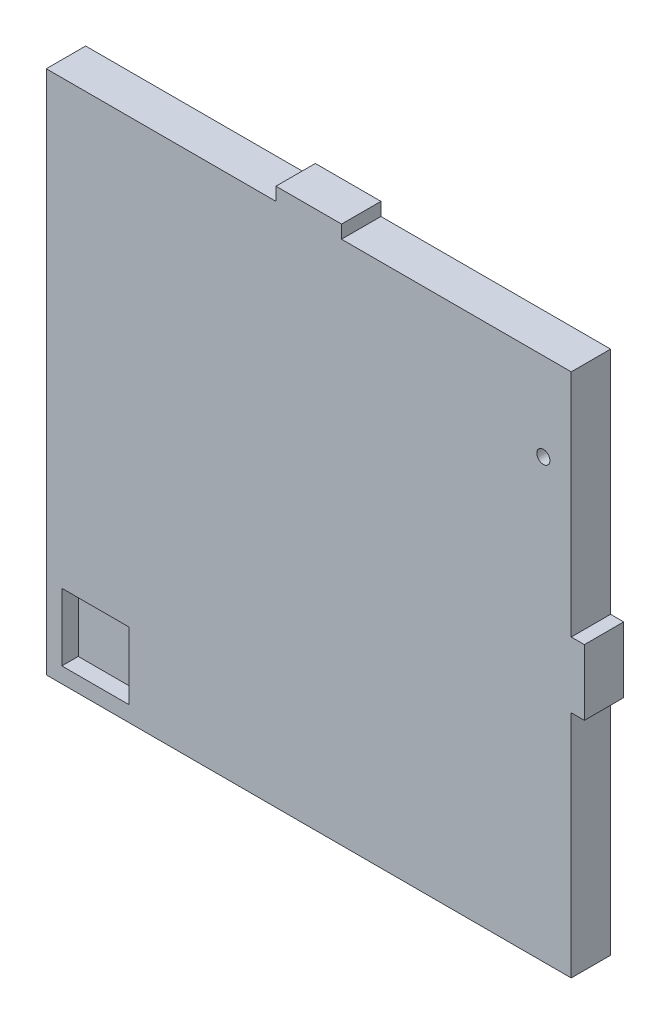
from build123d import *

# Parameters (mm, degrees)
SKETCH1_R           = 2
BOSS_EXTRUDE1_DEPTH = 12
SKETCH2_W           = 20.5
SKETCH2_H           = 20.5
CUT_EXTRUDE1_DEPTH  = 5
SKETCH4_R           = 3.45
CUT_EXTRUDE7_DEPTH  = 8


with BuildPart() as part:
    # Sketch1 → Boss-Extrude1 (new body)
    with BuildSketch(Plane.XY):
        Polygon((0, 0), (69.7, 0), (90.3, 0), (160, 0), (160, 70), (164, 70), (164, 90), (160, 90), (160, 160), (90, 160), (90, 164), (70, 164), (70, 160), (0, 160), (0, 90.3), (0, 69.7), align=None)
        with Locations((151.5, 133.3)):
            Circle(SKETCH1_R, mode=Mode.SUBTRACT)
    extrude(amount=BOSS_EXTRUDE1_DEPTH)

    # Sketch2 → Cut-Extrude1 (cut)
    with BuildSketch(Plane.XY.offset(12)):
        with Locations((15, 15)):
            Rectangle(SKETCH2_W, SKETCH2_H)
    extrude(amount=-CUT_EXTRUDE1_DEPTH, mode=Mode.SUBTRACT)

    # Sketch4 → Cut-Extrude7 (cut)
    with BuildSketch(Plane(origin=(0, 0, 0), x_dir=(-1, 0, 0), z_dir=(0, 0, -1))):
        with Locations((-151.5, 133.3)):
            Circle(SKETCH4_R)
    extrude(amount=-CUT_EXTRUDE7_DEPTH, mode=Mode.SUBTRACT)


solid = part.part
